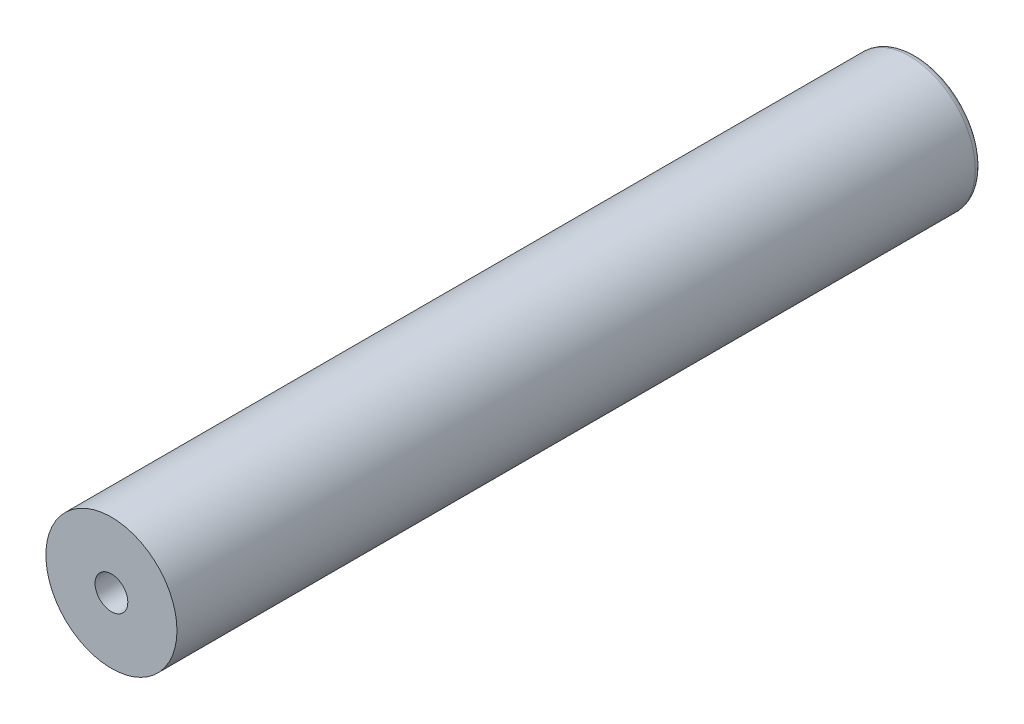
from build123d import *

# Parameters (mm, degrees)
ESBO_O1_R                                      = 5
RESSALTO_EXTRUS_O1_DEPTH                       = 61.4
FURO_ROSCADO_DE_M3X0_52_D                      = 2.5
FURO_ROSCADO_DE_M3X0_52_DEPTH                  = 8.5
FURO_ROSCADO_DE_M3X0_52_TIP                    = 0.751075774
FILETE1_R                                      = 0.5
BROCA_DE_ROSQUEAR_PARA_TARRAXA_DE_M3X0_5_D     = 2.5
BROCA_DE_ROSQUEAR_PARA_TARRAXA_DE_M3X0_5_DEPTH = 5
BROCA_DE_ROSQUEAR_PARA_TARRAXA_DE_M3X0_5_TIP   = 0.751075774


with BuildPart() as part:
    # Esboço1 → Ressalto-extrusão1 (new body)
    with BuildSketch(Plane.XY):
        with Locations((240.708388302, 2.596082859)):
            Circle(ESBO_O1_R)
    extrude(amount=RESSALTO_EXTRUS_O1_DEPTH)

    # Furo roscado de M3x0.52
    with Locations(Plane(origin=(0, 0, 0), x_dir=(-1, 0, 0), z_dir=(0, 0, -1))):
        with Locations((-240.708388302, 2.596082859)):
            Hole(FURO_ROSCADO_DE_M3X0_52_D / 2, depth=FURO_ROSCADO_DE_M3X0_52_DEPTH)
            with Locations((0, 0, -(FURO_ROSCADO_DE_M3X0_52_DEPTH + FURO_ROSCADO_DE_M3X0_52_TIP / 2))):  # 118° drill point
                Cone(0, FURO_ROSCADO_DE_M3X0_52_D / 2, FURO_ROSCADO_DE_M3X0_52_TIP, mode=Mode.SUBTRACT)

    # Filete1
    filete1_edges = [part.edges().sort_by_distance(p)[0] for p in [
        (235.708388302, 2.596082859, 0),
    ]]
    fillet(filete1_edges, radius=FILETE1_R)

    # Broca de rosquear para tarraxa de M3x0.51
    with Locations(Plane.XY.offset(61.4)):
        with Locations((240.708388302, 2.596082859)):
            Hole(BROCA_DE_ROSQUEAR_PARA_TARRAXA_DE_M3X0_5_D / 2, depth=BROCA_DE_ROSQUEAR_PARA_TARRAXA_DE_M3X0_5_DEPTH)
            with Locations((0, 0, -(BROCA_DE_ROSQUEAR_PARA_TARRAXA_DE_M3X0_5_DEPTH + BROCA_DE_ROSQUEAR_PARA_TARRAXA_DE_M3X0_5_TIP / 2))):  # 118° drill point
                Cone(0, BROCA_DE_ROSQUEAR_PARA_TARRAXA_DE_M3X0_5_D / 2, BROCA_DE_ROSQUEAR_PARA_TARRAXA_DE_M3X0_5_TIP, mode=Mode.SUBTRACT)


solid = part.part
